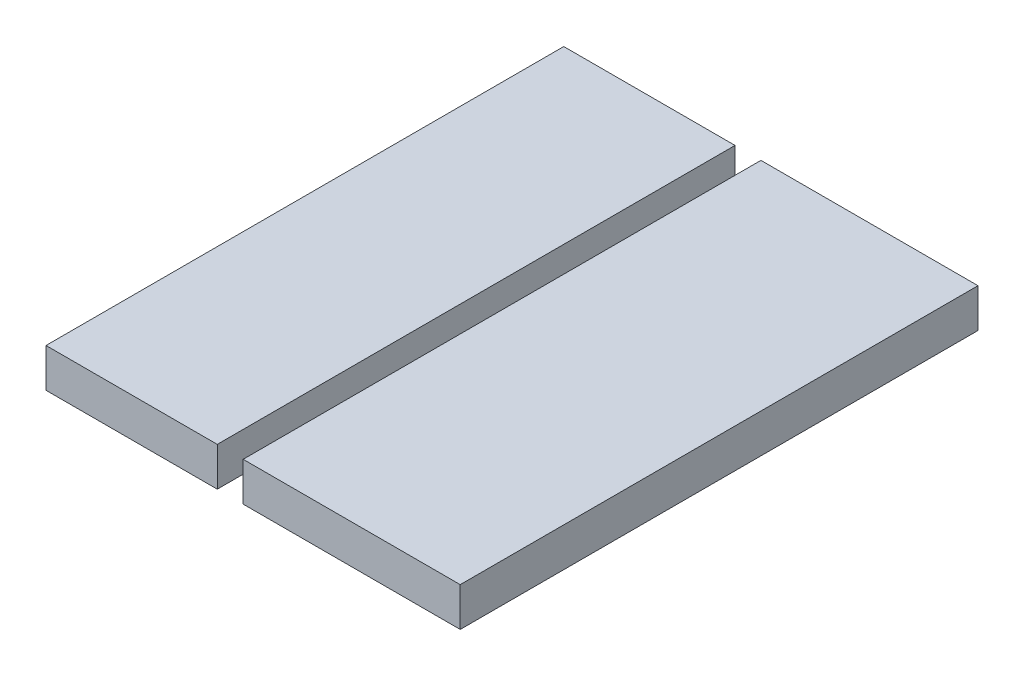
from build123d import *

# Parameters (mm, degrees)
SKETCH1_W           = 50.8
SKETCH1_H           = 63.5
BOSS_EXTRUDE1_DEPTH = 4.7625
SKETCH2_W           = 3.175
SKETCH2_H           = 63.5
CUT_EXTRUDE1_DEPTH  = 10


with BuildPart() as part:
    # Sketch1 → Boss-Extrude1 (new body)
    with BuildSketch(Plane(origin=(0, 0, 0), x_dir=(1, 0, 0), z_dir=(0, 1, 0))):
        with Locations((2.808564244, -8.645122522)):
            Rectangle(SKETCH1_W, SKETCH1_H)
    extrude(amount=BOSS_EXTRUDE1_DEPTH)

    # Sketch2 → Cut-Extrude1 (cut)
    with BuildSketch(Plane(origin=(0, 4.7625, 0), x_dir=(1, 0, 0), z_dir=(0, 1, 0))):
        with Locations((0, -8.645122522)):
            Rectangle(SKETCH2_W, SKETCH2_H)
    extrude(amount=-CUT_EXTRUDE1_DEPTH, mode=Mode.SUBTRACT)


with BuildPart() as cut_extrude1_piece_1:
    # of the separate pieces the step leaves, piece 1, a body of its own (cut_extrude1_pieces)
    add(part.part.solids().sort_by_distance((28.208564244, 0, -23.104877478))[0])


with BuildPart() as cut_extrude1_piece_2:
    # of the separate pieces the step leaves, piece 2, a body of its own (cut_extrude1_pieces)
    add(part.part.solids().sort_by_distance((-1.5875, 0, -23.104877478))[0])


solid = Compound([cut_extrude1_piece_1.part, cut_extrude1_piece_2.part])
